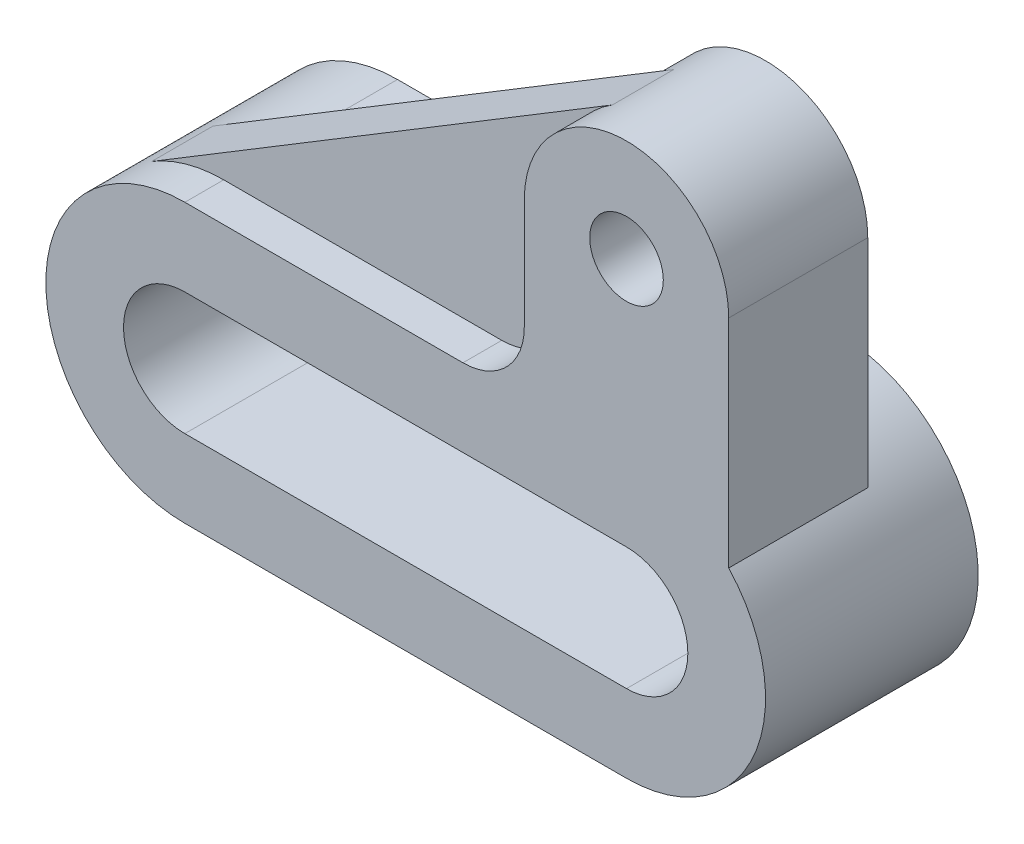
from build123d import *

# Parameters (mm, degrees)
BOSS_EXTRUDE1_DEPTH = 52
BOSS_EXTRUDE2_START = -34
BOSS_EXTRUDE2_DEPTH = 34
SKETCH2_3_R         = 9
CUT_EXTRUDE2_DEPTH  = 144.697599145
FILLET1_R           = 15
RIB3_REACH          = 140.456
SKETCH4_WALL_W      = 410.665096048
SKETCH4_WALL_H      = 15


with BuildPart() as part:
    # Sketch1 → Boss-Extrude1 (new body)
    with BuildSketch(Plane.XY):
        with BuildLine():
            Line((-54, 34), (54, 34))
            ThreePointArc((54, 34), (88, 0), (54, -34))
            Line((54, -34), (-54, -34))
            ThreePointArc((-54, -34), (-88, 0), (-54, 34))
        make_face()
        with BuildLine():
            Line((-54, 15), (54, 15))
            ThreePointArc((54, 15), (69, 0), (54, -15))
            Line((54, -15), (-54, -15))
            ThreePointArc((-54, -15), (-69, 0), (-54, 15))
        make_face(mode=Mode.SUBTRACT)
    extrude(amount=BOSS_EXTRUDE1_DEPTH)

    # Sketch2 → Boss-Extrude2 (add)
    with BuildSketch(Plane.XY.offset(52).offset(BOSS_EXTRUDE2_START)):
        with BuildLine():
            Line((29, 76), (29, 34))
            Line((29, 34), (54, 34))
            ThreePointArc((54, 34), (67.647767834, 31.140623519), (79, 23.043437244))
            Line((79, 23.043437244), (79, 76))
            ThreePointArc((79, 76), (54, 101), (29, 76))
        make_face()
    extrude(amount=BOSS_EXTRUDE2_DEPTH)

    # Sketch2<3> → Cut-Extrude2 (cut, through all)
    with BuildSketch(Plane.XY.offset(52)):
        with Locations((54, 76)):
            Circle(SKETCH2_3_R)
    extrude(amount=-CUT_EXTRUDE2_DEPTH, mode=Mode.SUBTRACT)

    # Fillet1
    fillet1_edges = [part.edges().sort_by_distance(p)[0] for p in [
        (29, 34, 35),
    ]]
    fillet(fillet1_edges, radius=FILLET1_R)

    # Sketch4 wall → Rib3 (add, up to next)
    with BuildSketch(Plane(origin=(-15.293433294, 63.226194681, 35), x_dir=(0.855125243419, 0.518421467599, 0), z_dir=(-0.518421467599, 0.855125243419, 0)), mode=Mode.PRIVATE) as rib3_sk1:
        Rectangle(SKETCH4_WALL_W, SKETCH4_WALL_H)
    rib3_tool1 = extrude(rib3_sk1.sketch, amount=-RIB3_REACH, mode=Mode.PRIVATE) - part.part
    add(rib3_tool1.solids().sort_by_distance((-15.293433294, 63.226194681, 35))[0])


solid = part.part
